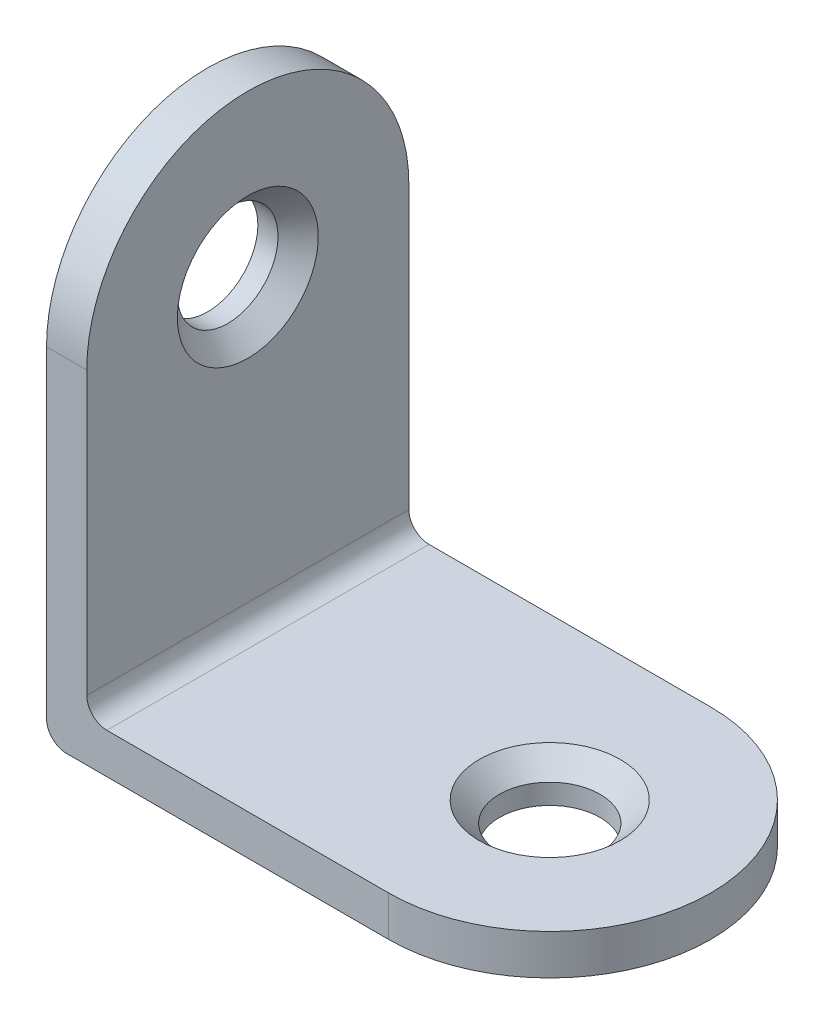
from build123d import *

# Parameters (mm, degrees)
EXTRUDE_1_DEPTH          = 16
CUT_EXTRUDE_1_DEPTH      = 37.249137921
CUT_EXTRUDE_1_DEPTH_BACK = 16
CUT_EXTRUDE_2_DEPTH      = 38.549966711
CUT_EXTRUDE_2_DEPTH_BACK = 16
SKETCH_4_R               = 2.5
CUT_EXTRUDE_3_DEPTH      = 16
SKETCH_5_R               = 2.5
CUT_EXTRUDE_4_DEPTH      = 16
FILLET_1_R               = 1
FILLET_2_R               = 1
CHAMFER_1_SIZE           = 1
CHAMFER_2_SIZE           = 1


with BuildPart() as part:
    # 草图1 → 凸台-拉伸1 (new body)
    with BuildSketch(Plane.XY):
        Polygon((0, 0), (0, 23), (-2, 23), (-2, -2), (23, -2), (23, 0), align=None)
    extrude(amount=EXTRUDE_1_DEPTH)

    # 草图2 → 切除-拉伸1 (cut, two sides: drawn at the far end of the back side and taken through both)
    with BuildSketch(Plane(origin=(0, 0, 0), x_dir=(0, 0, -1), z_dir=(1, 0, 0)).offset(-CUT_EXTRUDE_1_DEPTH_BACK)):
        with BuildLine():
            ThreePointArc((-16, 15), (-13.656854249, 20.656854249), (-8, 23))
            Line((-8, 23), (-16, 23))
            Line((-16, 23), (-16, 15))
        make_face()
        with BuildLine():
            ThreePointArc((-8, 23), (-2.343145751, 20.656854249), (0, 15))
            Line((0, 15), (0, 23))
            Line((0, 23), (-8, 23))
        make_face()
    extrude(amount=CUT_EXTRUDE_1_DEPTH + CUT_EXTRUDE_1_DEPTH_BACK, mode=Mode.SUBTRACT)

    # 草图3 → 切除-拉伸2 (cut, two sides: drawn at the far end of the back side and taken through both)
    with BuildSketch(Plane.XZ.offset(2).offset(-CUT_EXTRUDE_2_DEPTH_BACK)):
        with BuildLine():
            ThreePointArc((23, 8), (20.656854249, 2.343145751), (15, 0))
            Line((15, 0), (23, 0))
            Line((23, 0), (23, 8))
        make_face()
        with BuildLine():
            ThreePointArc((15, 16), (20.656854249, 13.656854249), (23, 8))
            Line((23, 8), (23, 16))
            Line((23, 16), (15, 16))
        make_face()
    extrude(amount=CUT_EXTRUDE_2_DEPTH + CUT_EXTRUDE_2_DEPTH_BACK, mode=Mode.SUBTRACT)

    # 草图4 → 切除-拉伸3 (cut)
    with BuildSketch(Plane(origin=(0, 0, 0), x_dir=(1, 0, 0), z_dir=(0, 1, 0))):
        with Locations(Location((15, -8, 0), (0, 0, 180))):
            Circle(SKETCH_4_R)
    extrude(amount=-CUT_EXTRUDE_3_DEPTH, mode=Mode.SUBTRACT)

    # 草图5 → 切除-拉伸4 (cut)
    with BuildSketch(Plane(origin=(0, 0, 0), x_dir=(0, 0, -1), z_dir=(1, 0, 0))):
        with Locations((-8, 15)):
            Circle(SKETCH_5_R)
    extrude(amount=-CUT_EXTRUDE_4_DEPTH, mode=Mode.SUBTRACT)

    # 圆角1
    fillet_1_edges = [part.edges().sort_by_distance(p)[0] for p in [
        (0, 0, 8),
    ]]
    fillet(fillet_1_edges, radius=FILLET_1_R)

    # 圆角2
    fillet_2_edges = [part.edges().sort_by_distance(p)[0] for p in [
        (-2, -2, 8),
    ]]
    fillet(fillet_2_edges, radius=FILLET_2_R)

    # 倒角1
    chamfer_1_edges = [part.edges().sort_by_distance(p)[0] for p in [
        (0, 15, 10.5),
    ]]
    chamfer(chamfer_1_edges, length=CHAMFER_1_SIZE)

    # 倒角2
    chamfer_2_edges = [part.edges().sort_by_distance(p)[0] for p in [
        (17.5, 0, 8),
    ]]
    chamfer(chamfer_2_edges, length=CHAMFER_2_SIZE)


solid = part.part
